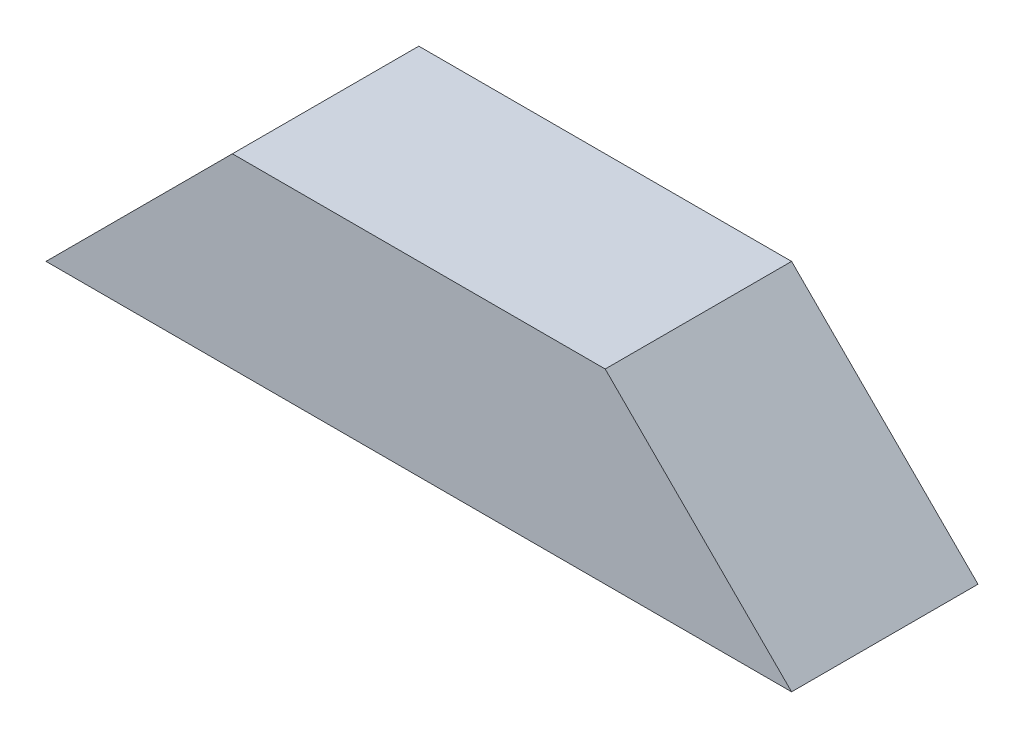
from build123d import *

# Parameters (mm, degrees)
ESQUISSE1_W                  = 80
ESQUISSE1_H                  = 20
BOSS_EXTRU_1_DEPTH           = 20
ENL_V_MAT_EXTRU_1_DEPTH      = 85.852813742
ENL_V_MAT_EXTRU_1_DEPTH_BACK = 85.852813742


with BuildPart() as part:
    # Esquisse1 → Boss.-Extru.1 (new body)
    with BuildSketch(Plane.XY):
        with Locations((40, 10)):
            Rectangle(ESQUISSE1_W, ESQUISSE1_H)
    extrude(amount=BOSS_EXTRU_1_DEPTH)

    # Esquisse2 → Enlèv. mat.-Extru.1 (cut, two sides: drawn at the far end of the back side and taken through both)
    with BuildSketch(Plane.XY.offset(20).offset(-ENL_V_MAT_EXTRU_1_DEPTH_BACK)):
        Polygon((0, 20), (20, 20), (0, 0), align=None)
        Polygon((80, 0), (80, 20), (60, 20), align=None)
    extrude(amount=ENL_V_MAT_EXTRU_1_DEPTH + ENL_V_MAT_EXTRU_1_DEPTH_BACK, mode=Mode.SUBTRACT)


solid = part.part
